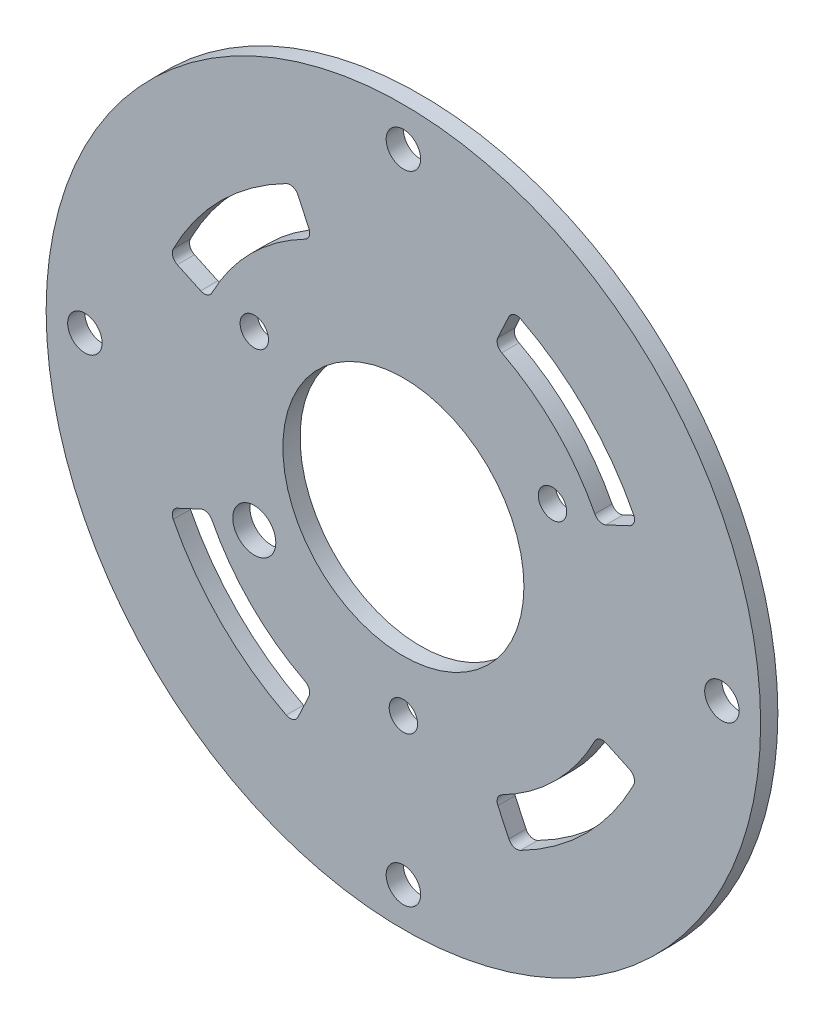
from build123d import *

# Parameters (mm, degrees)
SKETCH_1_R          = 41.5
SKETCH_1_R_2        = 2
SKETCH_1_R_3        = 14
EXTRUDE_1_DEPTH     = 2
CUT_EXTRUDE_3_DEPTH = 2
FILLET_1_R          = 1
SKETCH_5_R          = 1.65
CUT_EXTRUDE_4_DEPTH = 10
SKETCH_6_R          = 2.5
CUT_EXTRUDE_5_DEPTH = 10


with BuildPart() as part:
    # 草图1 → 凸台-拉伸1 (new body)
    with BuildSketch(Plane.XY):
        Circle(SKETCH_1_R)
        with Locations((0, -37)):
            Circle(SKETCH_1_R_2, mode=Mode.SUBTRACT)
        with Locations((-37, 0)):
            Circle(SKETCH_1_R_2, mode=Mode.SUBTRACT)
        with Locations((0, 37)):
            Circle(SKETCH_1_R_2, mode=Mode.SUBTRACT)
        with Locations((37, 0)):
            Circle(SKETCH_1_R_2, mode=Mode.SUBTRACT)
        Circle(SKETCH_1_R_3, mode=Mode.SUBTRACT)
    extrude(amount=EXTRUDE_1_DEPTH)

    # 草图4 → 切除-拉伸3 (cut)
    with BuildSketch(Plane.XY.offset(2)):
        with BuildLine():
            ThreePointArc((-10.565456544, 22.657694676), (-17.67766953, 17.67766953), (-22.657694676, 10.565456544))
            Line((-22.657694676, 10.565456544), (-27.189233611, 12.678547852))
            ThreePointArc((-27.189233611, 12.678547852), (-21.213203436, 21.213203436), (-12.678547852, 27.189233611))
            Line((-12.678547852, 27.189233611), (-10.565456544, 22.657694676))
        make_face()
        with BuildLine():
            Line((22.657694676, 10.565456544), (27.189233611, 12.678547852))
            ThreePointArc((27.189233611, 12.678547852), (21.213203436, 21.213203436), (12.678547852, 27.189233611))
            Line((12.678547852, 27.189233611), (10.565456544, 22.657694676))
            ThreePointArc((10.565456544, 22.657694676), (17.67766953, 17.67766953), (22.657694676, 10.565456544))
        make_face()
        with BuildLine():
            ThreePointArc((-22.657694676, -10.565456544), (-17.67766953, -17.67766953), (-10.565456544, -22.657694676))
            Line((-10.565456544, -22.657694676), (-12.678547852, -27.189233611))
            ThreePointArc((-12.678547852, -27.189233611), (-21.213203436, -21.213203436), (-27.189233611, -12.678547852))
            Line((-27.189233611, -12.678547852), (-22.657694676, -10.565456544))
        make_face()
        with BuildLine():
            ThreePointArc((10.565456544, -22.657694676), (17.67766953, -17.67766953), (22.657694676, -10.565456544))
            Line((22.657694676, -10.565456544), (27.189233611, -12.678547852))
            ThreePointArc((27.189233611, -12.678547852), (21.213203436, -21.213203436), (12.678547852, -27.189233611))
            Line((12.678547852, -27.189233611), (10.565456544, -22.657694676))
        make_face()
    extrude(amount=-CUT_EXTRUDE_3_DEPTH, mode=Mode.SUBTRACT)

    # 圆角1
    fillet_1_edges = [part.edges().sort_by_distance(p)[0] for p in [
        (27.189233611, 12.678547852, 1),
        (22.657694676, 10.565456544, 1),
        (10.565456544, 22.657694676, 1),
        (12.678547852, 27.189233611, 1),
        (-22.657694676, -10.565456544, 1),
        (-10.565456544, -22.657694676, 1),
        (-12.678547852, -27.189233611, 1),
        (-27.189233611, -12.678547852, 1),
        (10.565456544, -22.657694676, 1),
        (22.657694676, -10.565456544, 1),
        (27.189233611, -12.678547852, 1),
        (12.678547852, -27.189233611, 1),
        (-10.565456544, 22.657694676, 1),
        (-22.657694676, 10.565456544, 1),
        (-27.189233611, 12.678547852, 1),
        (-12.678547852, 27.189233611, 1),
    ]]
    fillet(fillet_1_edges, radius=FILLET_1_R)

    # 草图5 → 切除-拉伸4 (cut)
    with BuildSketch(Plane.XY.offset(2)):
        with Locations((-17.320508076, 10)):
            Circle(SKETCH_5_R)
        with Locations((17.320508076, 10)):
            Circle(SKETCH_5_R)
        with Locations((0, -20)):
            Circle(SKETCH_5_R)
    extrude(amount=-CUT_EXTRUDE_4_DEPTH, mode=Mode.SUBTRACT)

    # 草图6 → 切除-拉伸5 (cut)
    with BuildSketch(Plane.XY.offset(2)):
        with Locations((-17.320508076, -10)):
            Circle(SKETCH_6_R)
    extrude(amount=-CUT_EXTRUDE_5_DEPTH, mode=Mode.SUBTRACT)


solid = part.part
